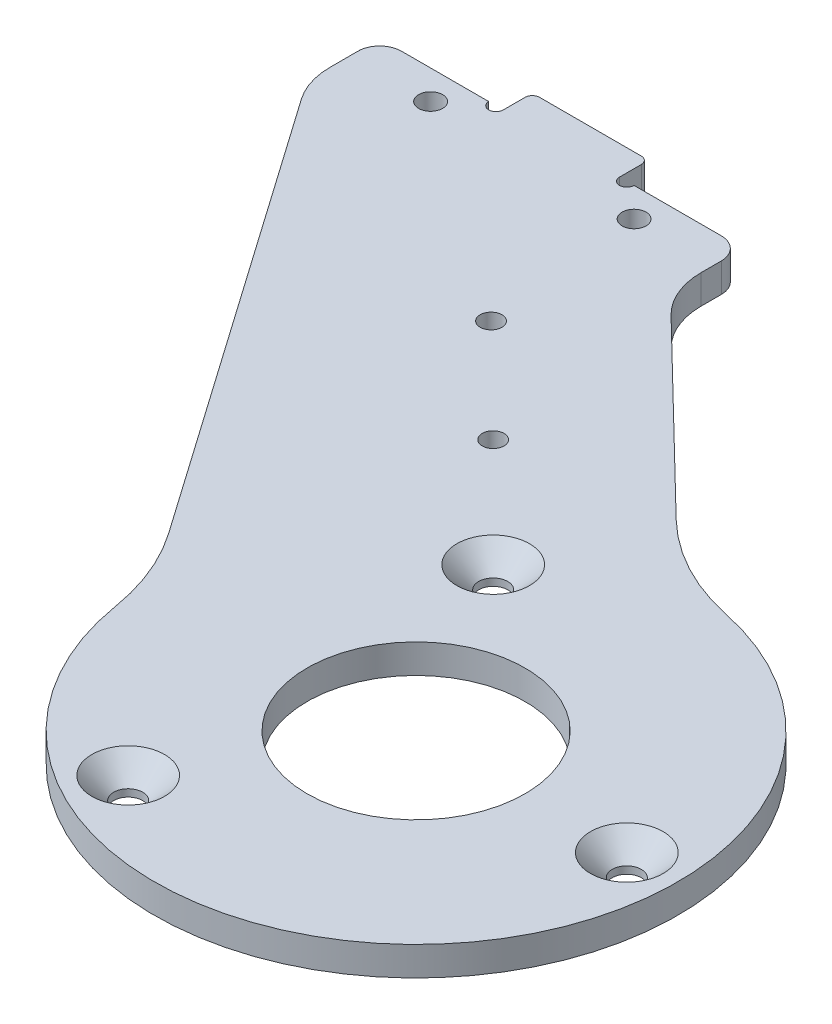
from build123d import *

# Parameters (mm, degrees)
EXTRUDE_1_DEPTH     = 4
FILLET_1_R          = 30
FILLET_2_R          = 30
SKETCH_4_R          = 1.65
CUT_EXTRUDE_3_DEPTH = 4
FILLET_4_R          = 10
FILLET_5_R          = 3
SKETCH_7_W          = 16
SKETCH_7_H          = 4
EXTRUDE_3_DEPTH     = 4
CUT_EXTRUDE_5_DEPTH = 4
FILLET_7_R          = 1
SKETCH_9_R          = 15
CUT_EXTRUDE_6_DEPTH = 10
SKETCH_10_R         = 2
CUT_EXTRUDE_7_DEPTH = 10
CHAMFER_1_SIZE      = 3
SKETCH_11_R         = 1.2
CUT_EXTRUDE_8_DEPTH = 10
SKETCH_12_R         = 1.5
CUT_EXTRUDE_9_DEPTH = 10


with BuildPart() as part:
    # 草图1 → 凸台-拉伸1 (new body)
    with BuildSketch(Plane(origin=(0, 0, 0), x_dir=(1, 0, 0), z_dir=(0, 1, 0))):
        with BuildLine():
            Line((-85, 80), (-35, 80))
            Line((-35, 80), (-35, 70))
            Line((-35, 70), (0, 36))
            ThreePointArc((0, 36), (25.455844123, -25.455844123), (-36, 0))
            Line((-36, 0), (-85, 70))
            Line((-85, 70), (-85, 80))
        make_face()
    extrude(amount=EXTRUDE_1_DEPTH)

    # 圆角1
    fillet_1_edges = [part.edges().sort_by_distance(p)[0] for p in [
        (0, 2, -36),
    ]]
    fillet(fillet_1_edges, radius=FILLET_1_R)

    # 圆角2
    fillet_2_edges = [part.edges().sort_by_distance(p)[0] for p in [
        (-36, 2, 0),
    ]]
    fillet(fillet_2_edges, radius=FILLET_2_R)

    # 草图4 → 切除-拉伸3 (cut)
    with BuildSketch(Plane(origin=(0, 4, 0), x_dir=(1, 0, 0), z_dir=(0, 1, 0))):
        with Locations(Location((-46, 76, 0), (0, 0, 270))):
            Circle(SKETCH_4_R)
        with Locations(Location((-74, 76, 0), (0, 0, 90))):
            Circle(SKETCH_4_R)
    extrude(amount=-CUT_EXTRUDE_3_DEPTH, mode=Mode.SUBTRACT)

    # 圆角4
    fillet_4_edges = [part.edges().sort_by_distance(p)[0] for p in [
        (-35, 2, -70),
        (-85, 2, -70),
    ]]
    fillet(fillet_4_edges, radius=FILLET_4_R)

    # 圆角5
    fillet_5_edges = [part.edges().sort_by_distance(p)[0] for p in [
        (-85, 2, -80),
        (-35, 2, -80),
    ]]
    fillet(fillet_5_edges, radius=FILLET_5_R)

    # 草图7 → 凸台-拉伸3 (add)
    with BuildSketch(Plane(origin=(0, 4, 0), x_dir=(1, 0, 0), z_dir=(0, 1, 0))):
        with Locations((-60, 82)):
            Rectangle(SKETCH_7_W, SKETCH_7_H)
    extrude(amount=-EXTRUDE_3_DEPTH)

    # 草图8 → 切除-拉伸5 (cut)
    with BuildSketch(Plane(origin=(0, 4, 0), x_dir=(1, 0, 0), z_dir=(0, 1, 0))):
        with BuildLine():
            Line((-50, 80), (-52, 80))
            ThreePointArc((-52, 80), (-51, 79), (-50, 80))
        make_face()
        with BuildLine():
            Line((-70, 80), (-68, 80))
            ThreePointArc((-68, 80), (-69, 79), (-70, 80))
        make_face()
    extrude(amount=-CUT_EXTRUDE_5_DEPTH, mode=Mode.SUBTRACT)

    # 圆角7
    fillet_7_edges = [part.edges().sort_by_distance(p)[0] for p in [
        (-52, 2, -84),
        (-68, 2, -84),
    ]]
    fillet(fillet_7_edges, radius=FILLET_7_R)

    # 草图9 → 切除-拉伸6 (cut)
    with BuildSketch(Plane(origin=(0, 4, 0), x_dir=(1, 0, 0), z_dir=(0, 1, 0))):
        with Locations(Location((0, 0, 0), (0, 0, 270))):
            Circle(SKETCH_9_R)
    extrude(amount=-CUT_EXTRUDE_6_DEPTH, mode=Mode.SUBTRACT)

    # 草图10 → 切除-拉伸7 (cut)
    with BuildSketch(Plane.XZ):
        with Locations(Location((29, 0, 0), (0, 0, 270))):
            Circle(SKETCH_10_R)
        with Locations(Location((-14.5, -25.11473671, 0), (0, 0, 270))):
            Circle(SKETCH_10_R)
        with Locations(Location((-14.5, 25.11473671, 0), (0, 0, 270))):
            Circle(SKETCH_10_R)
    extrude(amount=-CUT_EXTRUDE_7_DEPTH, mode=Mode.SUBTRACT)

    # 倒角1
    chamfer_1_edges = [part.edges().sort_by_distance(p)[0] for p in [
        (29, 4, 2),
        (-14.5, 4, -23.11473671),
        (-14.5, 4, 27.11473671),
    ]]
    chamfer(chamfer_1_edges, length=CHAMFER_1_SIZE)

    # 草图11 → 切除-拉伸8 (cut)
    with BuildSketch(Plane(origin=(0, 4, 0), x_dir=(1, 0, 0), z_dir=(0, 1, 0))):
        with Locations(Location((-29.401166302, 40.007142113, 0), (0, 0, 270))):
            Circle(SKETCH_11_R)
        with Locations(Location((-43.686880588, 54.004226358, 0), (0, 0, 270))):
            Circle(SKETCH_11_R)
    extrude(amount=-CUT_EXTRUDE_8_DEPTH, mode=Mode.SUBTRACT)

    # 草图12 → 切除-拉伸9 (cut)
    with BuildSketch(Plane(origin=(0, 4, 0), x_dir=(1, 0, 0), z_dir=(0, 1, 0))):
        with Locations(Location((-43.686880588, 54.004226358, 0), (0, 0, 270))):
            Circle(SKETCH_12_R)
        with Locations(Location((-29.401166302, 40.007142113, 0), (0, 0, 270))):
            Circle(SKETCH_12_R)
    extrude(amount=-CUT_EXTRUDE_9_DEPTH, mode=Mode.SUBTRACT)


solid = part.part
